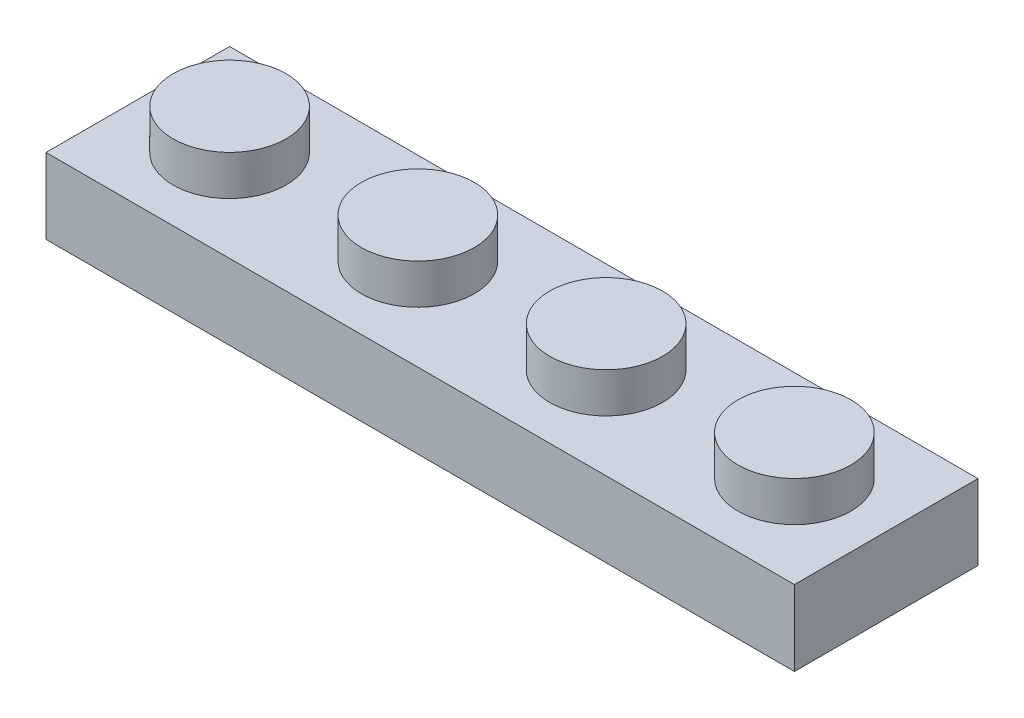
from build123d import *

# Parameters (mm, degrees)
BASE_SKETCH_W    = 31.8
BASE_SKETCH_H    = 7.8
BASE_BRICK_DEPTH = 3.2
CIRCLE_SKETCH_R  = 2.4
CIRCLE_DEPTH     = 1.7
LPATTERN1_COUNT  = 4
LPATTERN1_PITCH  = 8


with BuildPart() as part:
    # Base_Sketch → Base_Brick (new body)
    with BuildSketch(Plane(origin=(0, 0, 0), x_dir=(1, 0, 0), z_dir=(0, 1, 0))):
        with Locations((15.9, 3.9)):
            Rectangle(BASE_SKETCH_W, BASE_SKETCH_H)
    extrude(amount=BASE_BRICK_DEPTH)

    # Circle_Sketch → Circle (add)
    with BuildSketch(Plane(origin=(0, 3.2, 0), x_dir=(1, 0, 0), z_dir=(0, 1, 0))):
        with Locations(Location((3.9, 3.9, 0), (0, 0, 90))):
            Circle(CIRCLE_SKETCH_R)
    circle = extrude(amount=CIRCLE_DEPTH)

    # LPattern1: Circle ×4
    with Locations(*[(i * LPATTERN1_PITCH, 0, 0) for i in range(1, LPATTERN1_COUNT)]):
        add(circle)


solid = part.part
